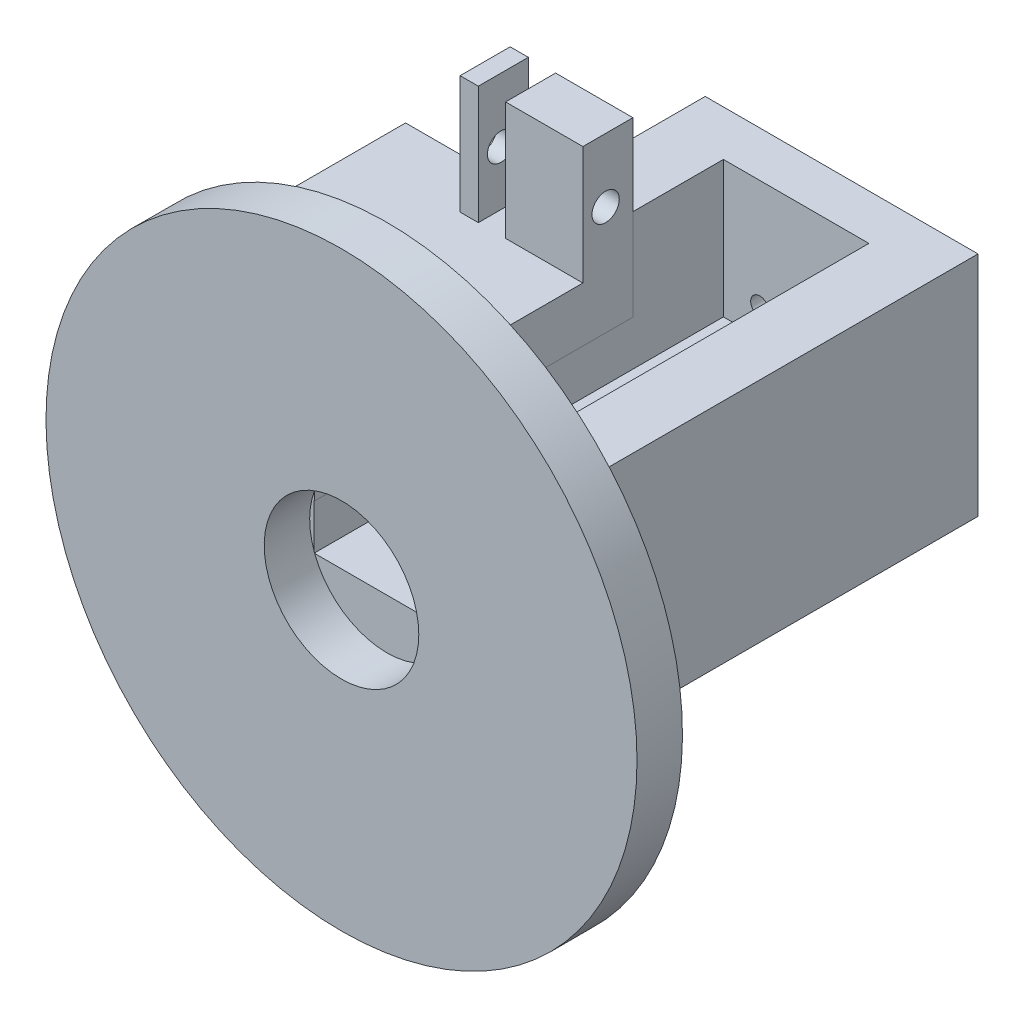
from build123d import *

# Parameters (mm, degrees)
CROQUIS1_R               = 32.5
CROQUIS1_R_2             = 8.5
SALIENTE_EXTRUIR1_DEPTH  = 5
CROQUIS3_W               = 30
CROQUIS3_H               = 10
SALIENTE_EXTRUIR5_DEPTH  = 50
CROQUIS4_W               = 7
CROQUIS4_H               = 50
SALIENTE_EXTRUIR6_DEPTH  = 5
CROQUIS5_W               = 25
CROQUIS5_H               = 35
SALIENTE_EXTRUIR7_DEPTH  = 6
CROQUIS6_W               = 8.5
CROQUIS6_H               = 5.5
CROQUIS6_W_2             = 2
CROQUIS6_H_2             = 7
SALIENTE_EXTRUIR8_DEPTH  = 13
CROQUIS7_R               = 1.5
CORTAR_EXTRUIR1_DEPTH    = 20
CROQUIS8_W               = 16
CROQUIS8_H               = 5
SALIENTE_EXTRUIR9_DEPTH  = 5
SALIENTE_EXTRUIR10_DEPTH = 10
CROQUIS11_R              = 1
CORTAR_EXTRUIR2_DEPTH    = 5
CROQUIS13_R              = 1.5
CORTAR_EXTRUIR3_DEPTH    = 10


with BuildPart() as part:
    # Croquis1 → Saliente-Extruir1 (new body)
    with BuildSketch(Plane.XY):
        Circle(CROQUIS1_R)
        Circle(CROQUIS1_R_2, mode=Mode.SUBTRACT)
    extrude(amount=SALIENTE_EXTRUIR1_DEPTH)

    # Croquis3 → Saliente-Extruir5 (add)
    with BuildSketch(Plane(origin=(0, 0, 0), x_dir=(-1, 0, 0), z_dir=(0, 0, -1))):
        with Locations((0, -8)):
            Rectangle(CROQUIS3_W, CROQUIS3_H)
    extrude(amount=SALIENTE_EXTRUIR5_DEPTH)

    # Croquis4 → Saliente-Extruir6 (add)
    with BuildSketch(Plane(origin=(0, -3, 0), x_dir=(1, 0, 0), z_dir=(0, 1, 0))):
        with Locations((-11.5, 25)):
            Rectangle(CROQUIS4_W, CROQUIS4_H)
        with Locations((11.5, 25)):
            Rectangle(CROQUIS4_W, CROQUIS4_H)
    extrude(amount=SALIENTE_EXTRUIR6_DEPTH)

    # Croquis5 → Saliente-Extruir7 (add)
    with BuildSketch(Plane(origin=(0, 2, 0), x_dir=(1, 0, 0), z_dir=(0, 1, 0))):
        with Locations((-20.45298686, 17.5)):
            Rectangle(CROQUIS5_W, CROQUIS5_H)
    extrude(amount=SALIENTE_EXTRUIR7_DEPTH)

    # Croquis6 → Saliente-Extruir8 (add)
    with BuildSketch(Plane(origin=(0, 8, 0), x_dir=(1, 0, 0), z_dir=(0, 1, 0))):
        with Locations((-12.20298686, 32.25)):
            Rectangle(CROQUIS6_W, CROQUIS6_H)
        with Locations((-20.45298686, 32.25)):
            Rectangle(CROQUIS6_W_2, CROQUIS6_H)
        with Locations((-12.20298686, 3.5)):
            Rectangle(CROQUIS6_W, CROQUIS6_H_2)
        with Locations((-20.45298686, 3.5)):
            Rectangle(CROQUIS6_W_2, CROQUIS6_H_2)
    extrude(amount=SALIENTE_EXTRUIR8_DEPTH)

    # Croquis7 → Cortar-Extruir1 (cut)
    with BuildSketch(Plane(origin=(-7.95298686, 0, 0), x_dir=(0, 0, -1), z_dir=(1, 0, 0))):
        with Locations((32, 14)):
            Circle(CROQUIS7_R)
        with Locations((4, 14)):
            Circle(CROQUIS7_R)
    extrude(amount=-CORTAR_EXTRUIR1_DEPTH, mode=Mode.SUBTRACT)

    # Croquis8 → Saliente-Extruir9 (add)
    with BuildSketch(Plane(origin=(0, -3, 0), x_dir=(1, 0, 0), z_dir=(0, 1, 0))):
        with Locations((0, 47.5)):
            Rectangle(CROQUIS8_W, CROQUIS8_H)
    extrude(amount=SALIENTE_EXTRUIR9_DEPTH)

    # Croquis10 → Saliente-Extruir10 (add)
    with BuildSketch(Plane(origin=(0, 2, 0), x_dir=(1, 0, 0), z_dir=(0, 1, 0))):
        Polygon((8, 0), (15, 0), (15, 50), (-15, 50), (-15, 35), (-8, 35), (-8, 45), (8, 45), align=None)
    extrude(amount=SALIENTE_EXTRUIR10_DEPTH)

    # Croquis11 → Cortar-Extruir2 (cut)
    with BuildSketch(Plane(origin=(0, 0, -50), x_dir=(-1, 0, 0), z_dir=(0, 0, -1))):
        with Locations((-4, 0)):
            Circle(CROQUIS11_R)
        with Locations((-12, 0)):
            Circle(CROQUIS11_R)
        with Locations((4, 0)):
            Circle(CROQUIS11_R)
        with Locations((12, 0)):
            Circle(CROQUIS11_R)
    extrude(amount=-CORTAR_EXTRUIR2_DEPTH, mode=Mode.SUBTRACT)

    # Croquis13 → Cortar-Extruir3 (cut)
    with BuildSketch(Plane(origin=(0, 0, -50), x_dir=(-1, 0, 0), z_dir=(0, 0, -1))):
        Circle(CROQUIS13_R)
    extrude(amount=-CORTAR_EXTRUIR3_DEPTH, mode=Mode.SUBTRACT)


solid = part.part
